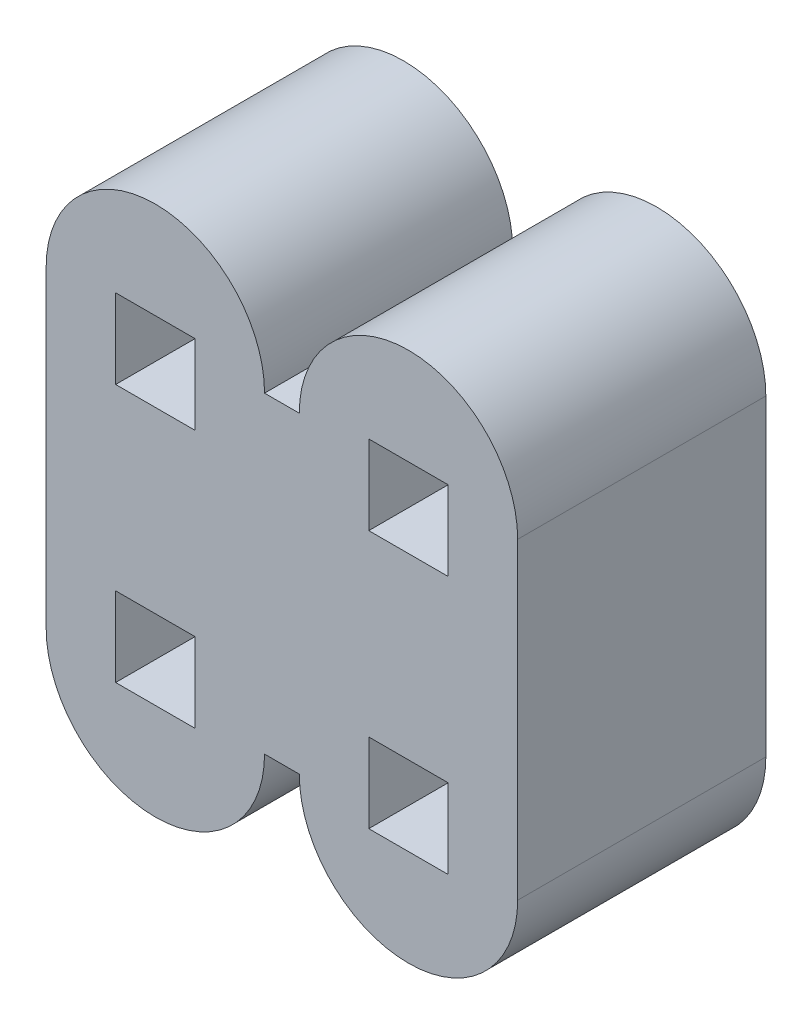
from build123d import *

# Parameters (mm, degrees)
SKICA1_W                 = 0.35
SKICA1_H                 = 3.148765599
P_IDAT_VYSUNUT_M1_DEPTH  = 2.5
SKICA2_W                 = 0.8
SKICA2_H                 = 0.8
ODEBRAT_VYSUNUT_M1_DEPTH = 2.5


with BuildPart() as part:
    # Skica1 → Přidat vysunutím1 (new body)
    with BuildSketch(Plane.XY):
        with BuildLine():
            Line((-12.89663996, -19.590083306), (-12.89663996, -16.441317707))
            ThreePointArc((-12.89663996, -16.441317707), (-13.99663996, -15.341317707), (-15.09663996, -16.441317707))
            Line((-15.09663996, -16.441317707), (-15.09663996, -19.590083306))
            ThreePointArc((-15.09663996, -19.590083306), (-13.99663996, -20.690083306), (-12.89663996, -19.590083306))
        make_face()
        with Locations((-12.72163996, -18.015700506)):
            Rectangle(SKICA1_W, SKICA1_H)
        with BuildLine():
            Line((-10.34663996, -19.590083306), (-10.34663996, -16.441317707))
            ThreePointArc((-10.34663996, -16.441317707), (-11.44663996, -15.341317707), (-12.54663996, -16.441317707))
            Line((-12.54663996, -16.441317707), (-12.54663996, -19.590083306))
            ThreePointArc((-12.54663996, -19.590083306), (-11.44663996, -20.690083306), (-10.34663996, -19.590083306))
        make_face()
    extrude(amount=P_IDAT_VYSUNUT_M1_DEPTH)

    # Skica2 → Odebrat vysunutím1 (cut)
    with BuildSketch(Plane.XY.offset(2.5)):
        with Locations((-13.99663996, -16.715700507)):
            Rectangle(SKICA2_W, SKICA2_H)
        with Locations((-13.99663996, -19.315700507)):
            Rectangle(SKICA2_W, SKICA2_H)
        with Locations((-11.44663996, -16.715700507)):
            Rectangle(SKICA2_W, SKICA2_H)
        with Locations((-11.44663996, -19.315700507)):
            Rectangle(SKICA2_W, SKICA2_H)
    extrude(amount=-ODEBRAT_VYSUNUT_M1_DEPTH, mode=Mode.SUBTRACT)


solid = part.part
